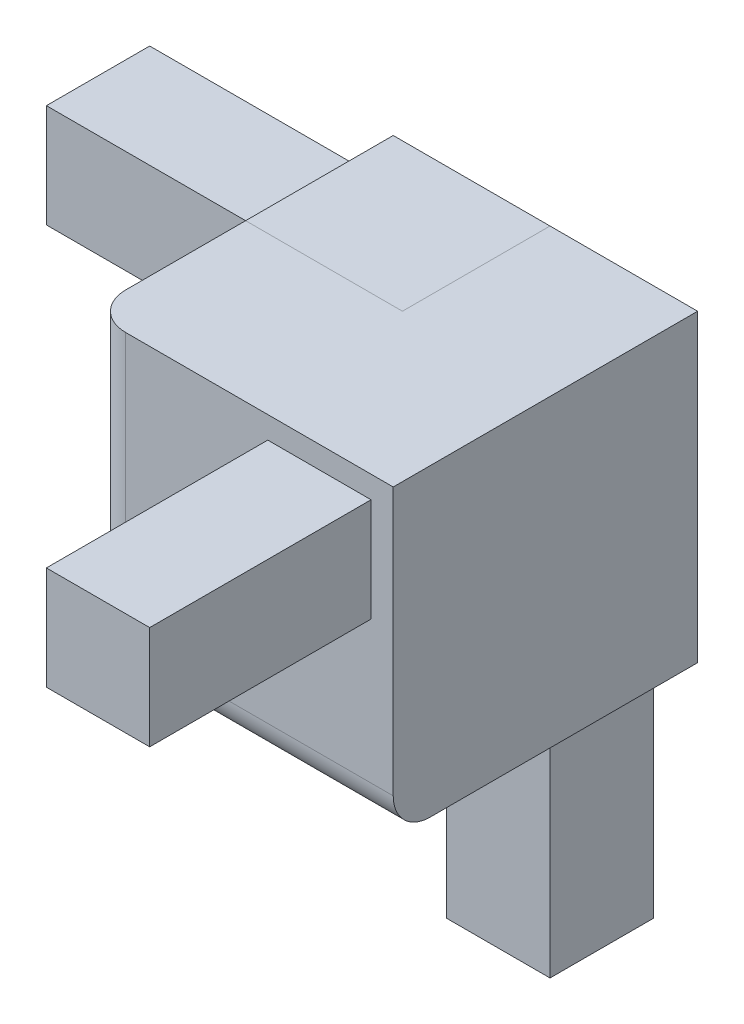
from build123d import *

# Parameters (mm, degrees)
BOSS_EXTRUDE1_DEPTH = 12
BOSS_EXTRUDE2_DEPTH = 12
BOSS_EXTRUDE3_DEPTH = 12
SKETCH4_W           = 8
SKETCH4_H           = 8
BOSS_EXTRUDE4_DEPTH = 16.5
BOSS_EXTRUDE5_REACH = 62.987
SKETCH5_W           = 7.999993884
SKETCH5_H           = 7.999993884
BOSS_EXTRUDE6_REACH = 43.723
SKETCH6_W           = 8
SKETCH6_H           = 8
SKETCH8_W           = 16.5
SKETCH8_H           = 16.5
BOSS_EXTRUDE7_DEPTH = 16.5
FILLET2_R           = 2


with BuildPart() as part:
    # Sketch1 → Boss-Extrude1 (new body)
    with BuildSketch(Plane(origin=(0, 35.05419916, 0), x_dir=(0.9999999620637957, 0, 0.0002754494639987688), z_dir=(0, 1, 0))):
        Polygon((19.25571253, 21.300030132), (24.855712318, 21.301572649), (24.854169801, 26.901572436), (19.254170013, 26.900029919), align=None)
    extrude(amount=-BOSS_EXTRUDE1_DEPTH)


with BuildPart() as body_2:
    # Sketch2 → Boss-Extrude2 (new body)
    with BuildSketch(Plane(origin=(9.561578882, 0, 0), x_dir=(0, 7.645378823372435e-07, -0.9999999999997079), z_dir=(1, 0, 0))):
        Polygon((26.894759564, 44.754178598), (26.894763846, 50.354178598), (21.294763846, 50.35418288), (21.294759564, 44.75418288), align=None)
    extrude(amount=-BOSS_EXTRUDE2_DEPTH)


with BuildPart() as body_3:
    # Sketch3 → Boss-Extrude3 (new body)
    with BuildSketch(Plane(origin=(0, 0, -11.594725348), x_dir=(-0.9999999616408898, -0.00027698053959765705, 0), z_dir=(0, 0, -1))):
        Polygon((-24.875525061, 50.347311055), (-24.87397397, 44.74731127), (-19.273974185, 44.748862361), (-19.275525276, 50.348862146), align=None)
    extrude(amount=-BOSS_EXTRUDE3_DEPTH)

    # Sketch4 → Boss-Extrude4 (add)
    with BuildSketch(Plane(origin=(0, 0, -11.594725348), x_dir=(-1, 0, 0), z_dir=(0, 0, -1))):
        with Locations((-22.061578882, 47.55419916)):
            Rectangle(SKETCH4_W, SKETCH4_H)
    extrude(amount=BOSS_EXTRUDE4_DEPTH)

    # Boss-Extrude5: up to this face of the body (flat: up to its plane)
    boss_extrude5_end = Plane(body_3.part.faces().sort_by_distance((26.061578882, 47.55419916, -19.844725348))[0])
    # Sketch5 → Boss-Extrude5 (add, up to the picked face)
    with BuildSketch(Plane(origin=(9.561578882, 0, 0), x_dir=(0, 7.645378823474896e-07, -0.9999999999997079), z_dir=(1, 0, 0)), mode=Mode.PRIVATE) as boss_extrude5_sk1:
        with Locations((24.094767821, 47.554180739)):
            Rectangle(SKETCH5_W, SKETCH5_H)
    boss_extrude5_tool1 = split(extrude(boss_extrude5_sk1.sketch, amount=BOSS_EXTRUDE5_REACH, mode=Mode.PRIVATE), bisect_by=boss_extrude5_end, keep=Keep.BOTH, mode=Mode.PRIVATE)

    add(body_2.part)  # Boss-Extrude5 merges body 2
    add(boss_extrude5_tool1.solids().sort_by(Axis((9.561579, 47.554199, -24.094731), (1, 0, 0)))[0])

    # Boss-Extrude6: up to this face of the body (flat: up to its plane)
    boss_extrude6_end = Plane(body_3.part.faces().sort_by_distance((22.061578882, 51.55419916, -19.844725348))[0])
    # Sketch6 → Boss-Extrude6 (add, up to the picked face)
    with BuildSketch(Plane(origin=(0, 35.05419916, 0), x_dir=(1, 0, 0), z_dir=(0, 1, 0)), mode=Mode.PRIVATE) as boss_extrude6_sk1:
        with Locations((22.061578882, 24.094737957)):
            Rectangle(SKETCH6_W, SKETCH6_H)
    boss_extrude6_tool1 = split(extrude(boss_extrude6_sk1.sketch, amount=BOSS_EXTRUDE6_REACH, mode=Mode.PRIVATE), bisect_by=boss_extrude6_end, keep=Keep.BOTH, mode=Mode.PRIVATE)

    add(part.part)  # Boss-Extrude6 merges part
    add(boss_extrude6_tool1.solids().sort_by(Axis((22.061579, 35.054199, -24.094738), (0, 1, 0)))[0])

    # Sketch8 → Boss-Extrude7 (add)
    with BuildSketch(Plane.XY.offset(-11.594725348)):
        with Locations((17.811578882, 43.30419916)):
            Rectangle(SKETCH8_W, SKETCH8_H)
    extrude(amount=-BOSS_EXTRUDE7_DEPTH)

    # Fillet2
    fillet2_edges = [body_3.edges().sort_by_distance(p)[0] for p in [
        (9.561578882, 35.05419916, -19.844725348),
        (9.561578882, 43.30419916, -11.594725348),
        (17.811578882, 35.05419916, -11.594725348),
    ]]
    fillet(fillet2_edges, radius=FILLET2_R)


solid = body_3.part
